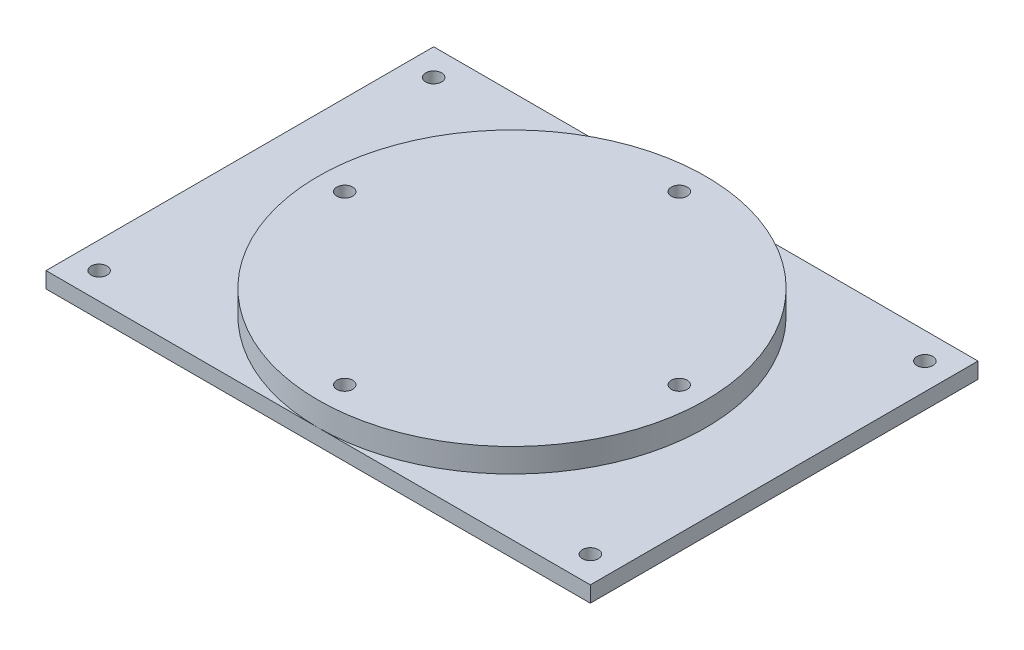
from build123d import *

# Parameters (mm, degrees)
SKETCH1_R             = 1.5
BOSS_EXTRUDE3_DEPTH   = 3
BOSS_EXTRUDE3_2_DEPTH = 3
SKETCH1_7_R           = 36.5
SKETCH1_7_R_2         = 1.5
BOSS_EXTRUDE4_DEPTH   = 7.5
SKETCH1_9_R           = 3.25
SKETCH1_9_R_2         = 1.5
CUT_EXTRUDE2_DEPTH    = 2.5


with BuildPart() as part:
    # Sketch1 → Boss-Extrude3 (new body)
    with BuildSketch(Plane(origin=(0, 0, 0), x_dir=(1, 0, 0), z_dir=(0, 1, 0))):
        with BuildLine():
            Line((0, 36.5), (-51.25, 36.5))
            Line((-51.25, 36.5), (-51.25, -36.5))
            Line((-51.25, -36.5), (0, -36.5))
            ThreePointArc((0, -36.5), (-36.5, 0), (0, 36.5))
        make_face()
        with Locations((-46.25, 31.5)):
            Circle(SKETCH1_R, mode=Mode.SUBTRACT)
        with Locations((-46.25, -31.5)):
            Circle(SKETCH1_R, mode=Mode.SUBTRACT)
    extrude(amount=BOSS_EXTRUDE3_DEPTH)



with BuildPart() as body_2:
    # Sketch1 → Boss-Extrude3 2 (new body)
    with BuildSketch(Plane(origin=(0, 0, 0), x_dir=(1, 0, 0), z_dir=(0, 1, 0))):
        with BuildLine():
            Line((51.25, 36.5), (0, 36.5))
            ThreePointArc((0, 36.5), (36.5, 0), (0, -36.5))
            Line((0, -36.5), (51.25, -36.5))
            Line((51.25, -36.5), (51.25, 36.5))
        make_face()
        with Locations((46.25, -31.5)):
            Circle(SKETCH1_R, mode=Mode.SUBTRACT)
        with Locations((46.25, 31.5)):
            Circle(SKETCH1_R, mode=Mode.SUBTRACT)
    extrude(amount=BOSS_EXTRUDE3_2_DEPTH)


with BuildPart() as part_1:
    add(part.part)

    add(body_2.part)  # Boss-Extrude4 merges body 2
    # Sketch1<7> → Boss-Extrude4 (add)
    with BuildSketch(Plane(origin=(0, 0, 0), x_dir=(1, 0, 0), z_dir=(0, 1, 0))):
        Circle(SKETCH1_7_R)
        with Locations((0, 31.5)):
            Circle(SKETCH1_7_R_2, mode=Mode.SUBTRACT)
        with Locations((31.5, 0)):
            Circle(SKETCH1_7_R_2, mode=Mode.SUBTRACT)
        with Locations((-31.5, 0)):
            Circle(SKETCH1_7_R_2, mode=Mode.SUBTRACT)
        with Locations((0, -31.5)):
            Circle(SKETCH1_7_R_2, mode=Mode.SUBTRACT)
    extrude(amount=BOSS_EXTRUDE4_DEPTH)

    # Sketch1<9> → Cut-Extrude2 (cut)
    # profile 1 of 4: a face of its own
    with BuildSketch(Plane(origin=(0, 0, 0), x_dir=(1, 0, 0), z_dir=(0, 1, 0))):
        with Locations((0, 31.5)):
            Circle(SKETCH1_9_R)
        with Locations((0, 31.5)):
            Circle(SKETCH1_9_R_2, mode=Mode.SUBTRACT)
    # profile 2 of 4: a face of its own
    with BuildSketch(Plane(origin=(0, 0, 0), x_dir=(1, 0, 0), z_dir=(0, 1, 0))):
        with Locations((0, -31.5)):
            Circle(SKETCH1_9_R)
        with Locations((0, -31.5)):
            Circle(SKETCH1_9_R_2, mode=Mode.SUBTRACT)
    # profile 3 of 4: a face of its own
    with BuildSketch(Plane(origin=(0, 0, 0), x_dir=(1, 0, 0), z_dir=(0, 1, 0))):
        with Locations((31.5, 0)):
            Circle(SKETCH1_9_R)
        with Locations((31.5, 0)):
            Circle(SKETCH1_9_R_2, mode=Mode.SUBTRACT)
    # profile 4 of 4: a face of its own
    with BuildSketch(Plane(origin=(0, 0, 0), x_dir=(1, 0, 0), z_dir=(0, 1, 0))):
        with Locations((-31.5, 0)):
            Circle(SKETCH1_9_R)
        with Locations((-31.5, 0)):
            Circle(SKETCH1_9_R_2, mode=Mode.SUBTRACT)
    extrude(amount=CUT_EXTRUDE2_DEPTH, mode=Mode.SUBTRACT)


solid = part_1.part
